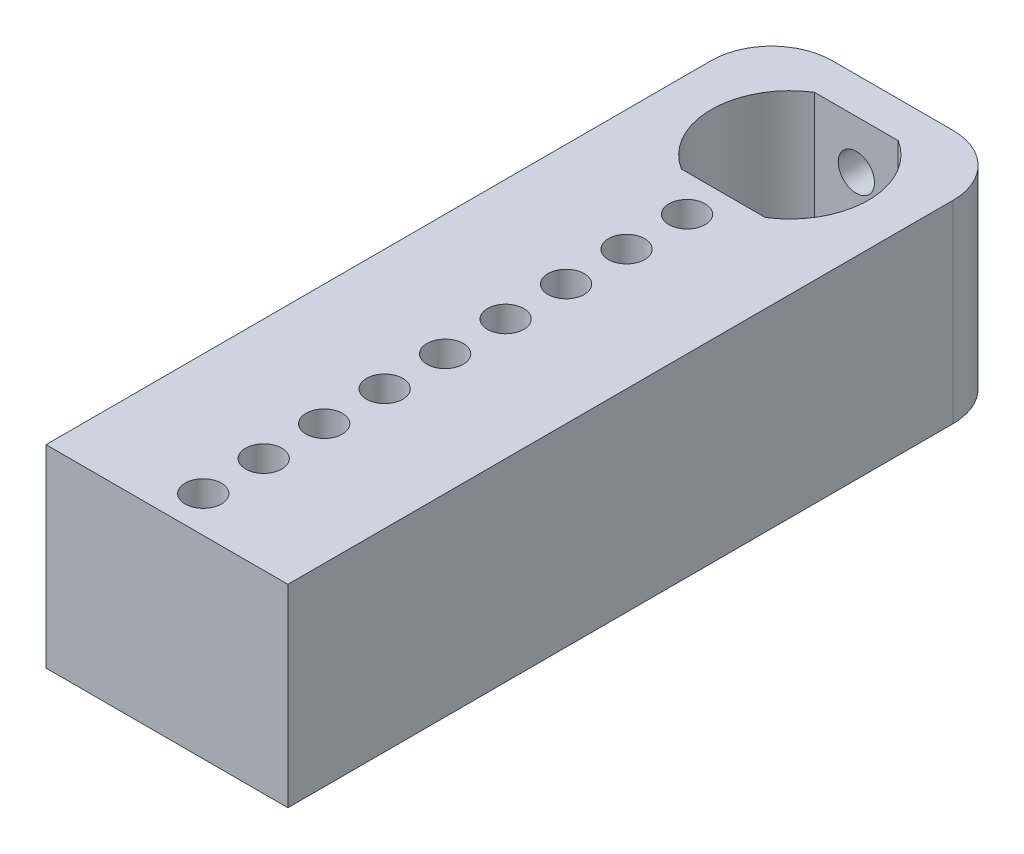
from build123d import *

# Parameters (mm, degrees)
CROQUIS1_W              = 20
CROQUIS1_H              = 60
SALIENTE_EXTRUIR1_DEPTH = 16
CORTAR_EXTRUIR1_DEPTH   = 36.440090293
CROQUIS3_R              = 1.5
CORTAR_EXTRUIR2_DEPTH   = 3
CROQUIS4_R              = 1.5
CORTAR_EXTRUIR3_DEPTH   = 8
REDONDEO1_R             = 5


with BuildPart() as part:
    # Croquis1 → Saliente-Extruir1 (new body)
    with BuildSketch(Plane(origin=(0, 0, 0), x_dir=(1, 0, 0), z_dir=(0, 1, 0))):
        Rectangle(CROQUIS1_W, CROQUIS1_H)
    extrude(amount=SALIENTE_EXTRUIR1_DEPTH)

    # Croquis2 → Cortar-Extruir1 (cut, through all)
    with BuildSketch(Plane(origin=(0, 16, 0), x_dir=(1, 0, 0), z_dir=(0, 1, 0))):
        with BuildLine():
            Line((-3.464101615, 27), (3.464101615, 27))
            ThreePointArc((3.464101615, 27), (6.5, 21.5), (3.464101615, 16))
            Line((3.464101615, 16), (-3.464101615, 16))
            ThreePointArc((-3.464101615, 16), (-6.5, 21.5), (-3.464101615, 27))
        make_face()
    extrude(amount=-CORTAR_EXTRUIR1_DEPTH, mode=Mode.SUBTRACT)

    # Croquis3 → Cortar-Extruir2 (cut)
    with BuildSketch(Plane(origin=(0, 0, -30), x_dir=(-1, 0, 0), z_dir=(0, 0, -1))):
        with Locations((0, 12)):
            Circle(CROQUIS3_R)
        with Locations((0, 4)):
            Circle(CROQUIS3_R)
    extrude(amount=-CORTAR_EXTRUIR2_DEPTH, mode=Mode.SUBTRACT)

    # Croquis4 → Cortar-Extruir3 (cut)
    with BuildSketch(Plane(origin=(0, 16, 0), x_dir=(1, 0, 0), z_dir=(0, 1, 0))):
        with Locations(Location((0, 13, 0), (0, 0, 270))):
            Circle(CROQUIS4_R)
        with Locations(Location((0, 8, 0), (0, 0, 270))):
            Circle(CROQUIS4_R)
        with Locations(Location((0, 3, 0), (0, 0, 270))):
            Circle(CROQUIS4_R)
        with Locations(Location((0, -2, 0), (0, 0, 270))):
            Circle(CROQUIS4_R)
        with Locations(Location((0, -7, 0), (0, 0, 270))):
            Circle(CROQUIS4_R)
        with Locations(Location((0, -12, 0), (0, 0, 270))):
            Circle(CROQUIS4_R)
        with Locations(Location((0, -17, 0), (0, 0, 270))):
            Circle(CROQUIS4_R)
        with Locations(Location((0, -22, 0), (0, 0, 270))):
            Circle(CROQUIS4_R)
        with Locations(Location((0, -27, 0), (0, 0, 270))):
            Circle(CROQUIS4_R)
    extrude(amount=-CORTAR_EXTRUIR3_DEPTH, mode=Mode.SUBTRACT)

    # Redondeo1
    redondeo1_edges = [part.edges().sort_by_distance(p)[0] for p in [
        (-10, 8, -30),
        (10, 8, -30),
    ]]
    fillet(redondeo1_edges, radius=REDONDEO1_R)


solid = part.part
